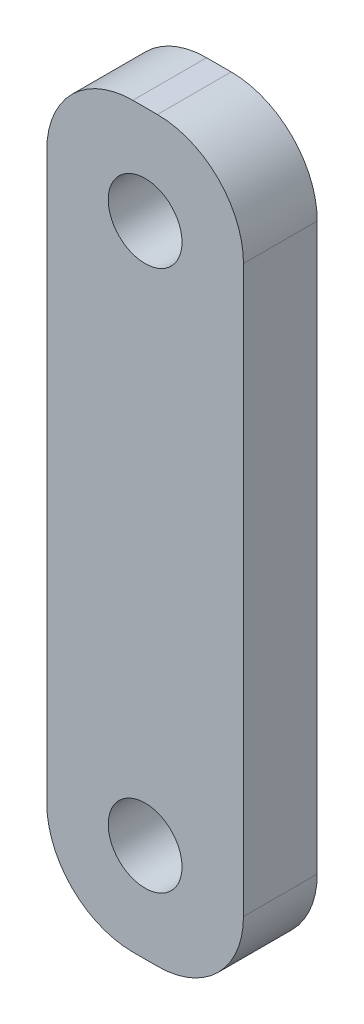
from build123d import *

# Parameters (mm, degrees)
SKETCH1_W           = 30
SKETCH1_H           = 8
BOSS_EXTRUDE1_DEPTH = 3
SKETCH2_R           = 1.5
CUT_EXTRUDE1_DEPTH  = 4
FILLET1_R           = 3.5
SCALE1_SCALE        = 0.75
SCALE2_SCALE        = 0.7


with BuildPart() as part:
    # Sketch1 → Boss-Extrude1 (new body)
    with BuildSketch(Plane(origin=(0, 0, 0), x_dir=(0, 1, 0), z_dir=(0, 0, 1))):
        Rectangle(SKETCH1_W, SKETCH1_H)
    extrude(amount=-BOSS_EXTRUDE1_DEPTH)

    # Sketch2 → Cut-Extrude1 (cut)
    with BuildSketch(Plane.XY):
        with Locations((0, 11)):
            Circle(SKETCH2_R)
        with Locations((0, -11)):
            Circle(SKETCH2_R)
    extrude(amount=-CUT_EXTRUDE1_DEPTH, mode=Mode.SUBTRACT)

    # Fillet1
    fillet1_edges = [part.edges().sort_by_distance(p)[0] for p in [
        (4, 15, -1.5),
        (4, -15, -1.5),
        (-4, -15, -1.5),
        (-4, 15, -1.5),
    ]]
    fillet(fillet1_edges, radius=FILLET1_R)


with BuildPart() as part_1:
    # Scale1: scaled about (0, 0, -1.5)
    add(part.part.scale(SCALE1_SCALE).moved(Location((0, 0, -0.375))))


with BuildPart() as part_2:
    # Scale2: scaled about (0, 0, -1.5)
    add(part_1.part.scale(SCALE2_SCALE).moved(Location((0, 0, -0.45))))


solid = part_2.part
